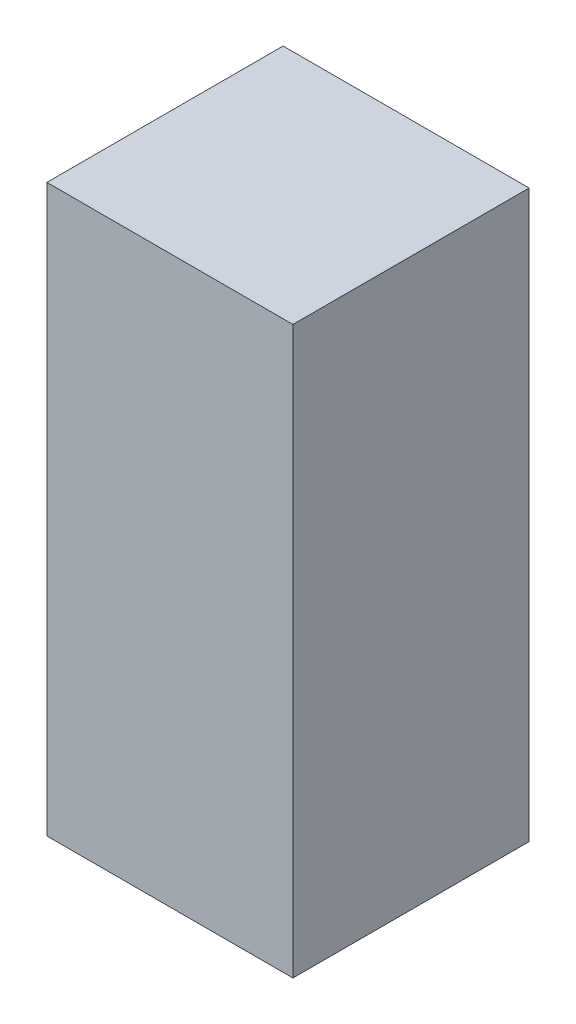
from build123d import *

# Parameters (mm, degrees)
SKETCH1_W           = 49.98729897
SKETCH1_H           = 115
BOSS_EXTRUDE1_DEPTH = 48


with BuildPart() as part:
    # Sketch1 → Boss-Extrude1 (new body)
    with BuildSketch(Plane.XY):
        Rectangle(SKETCH1_W, SKETCH1_H)
    extrude(amount=BOSS_EXTRUDE1_DEPTH)


solid = part.part
